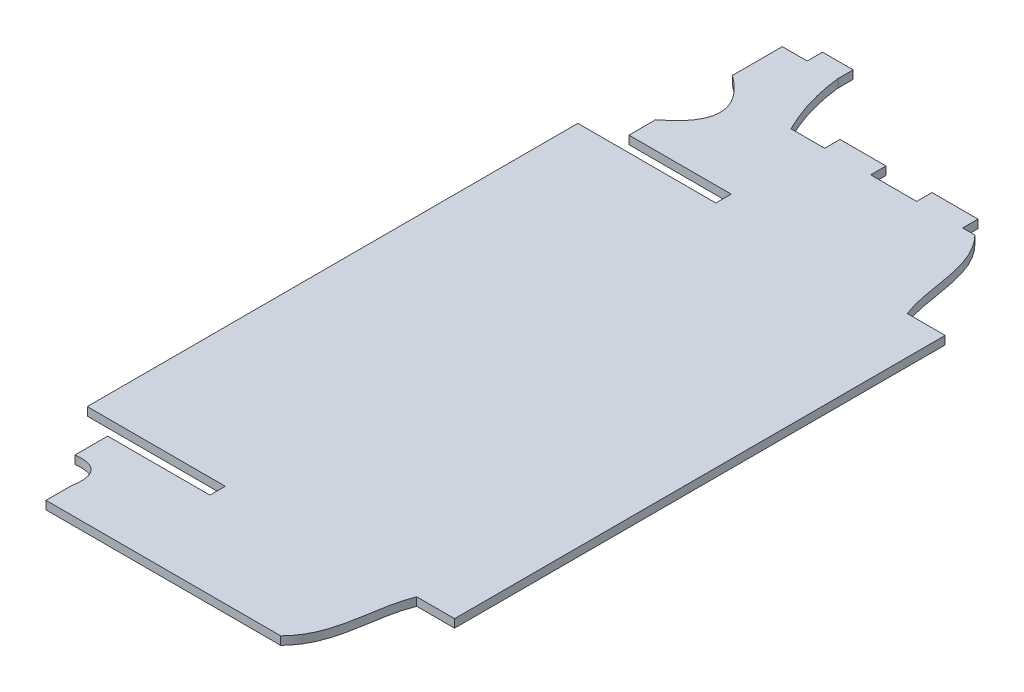
from build123d import *

# Parameters (mm, degrees)
SKETCH1_W           = 119.784208154
SKETCH1_H           = 2.7
BOSS_EXTRUDE1_DEPTH = 80
BOSS_EXTRUDE2_DEPTH = 2.7


with BuildPart() as part:
    # Sketch1 → Boss-Extrude1 (new, symmetric)
    with BuildSketch(Plane.XY):
        with Locations((-129.502935336, -130)):
            Rectangle(SKETCH1_W, SKETCH1_H)
    extrude(amount=BOSS_EXTRUDE1_DEPTH, both=True)

    # Sketch2 → Boss-Extrude2 (add)
    with BuildSketch(Plane(origin=(0, -128.65, 0), x_dir=(1, 0, 0), z_dir=(0, 1, 0))):
        with BuildLine():
            Line((-169.648055861, -113.2), (-93.105798555, -113.2))
            add(Edge.make_bspline(
                [(-81.948677427, -80), (-86.342810108, -90.98944534), (-84.004205112, -103.888102009), (-93.105798555, -113.2)],
                knots=[0, 0, 0, 0, 1, 1, 1, 1], degree=3))
            Line((-81.948677427, -80), (-81.948677427, -77.720195576))
            Line((-81.948677427, -77.720195576), (-177.731759246, -77.720195576))
            Line((-177.731759246, -77.720195576), (-177.731759246, -80))
            Line((-177.731759246, -80), (-144.395039413, -80))
            Line((-144.395039413, -80), (-144.395039413, -85))
            Line((-144.395039413, -85), (-177.731759246, -85))
            Line((-177.731759246, -85), (-177.731759246, -95.646483093))
            add(Edge.make_bspline(
                [(-169.648055861, -105.087652523), (-167.760228738, -94.514197341), (-177.731759246, -95.646483093)],
                knots=[0, 0, 0, 1, 1, 1], degree=2))
            Line((-169.648055861, -105.087652523), (-169.648055861, -113.2))
        make_face()
        with BuildLine():
            Line((-177.731759246, 80), (-177.731759246, 77.720195576))
            Line((-177.731759246, 77.720195576), (-81.948677427, 77.720195576))
            Line((-81.948677427, 77.720195576), (-81.948677427, 80))
            add(Edge.make_bspline(
                [(-81.948677427, 80), (-86.342810108, 90.98944534), (-84.004205112, 103.888102009), (-93.105798555, 113.2)],
                knots=[0, 0, 0, 0, 1, 1, 1, 1], degree=3))
            Line((-93.105798555, 113.2), (-97.105798555, 113.2))
            Line((-97.105798555, 113.2), (-97.105798555, 118.2))
            Line((-97.105798555, 118.2), (-112.105798555, 118.2))
            Line((-112.105798555, 118.2), (-112.105798555, 113.2))
            Line((-112.105798555, 113.2), (-127.105798555, 113.2))
            Line((-127.105798555, 113.2), (-127.105798555, 118.2))
            Line((-127.105798555, 118.2), (-142.105798555, 118.2))
            Line((-142.105798555, 118.2), (-142.105798555, 113.2))
            Line((-142.105798555, 113.2), (-153.105798555, 113.2))
            add(Edge.make_bspline(
                [(-153.105798555, 113.2), (-158.310437451, 123.519674565), (-159.620228805, 135)],
                knots=[0, 0, 0, 1, 1, 1], degree=2))
            Line((-159.620228805, 135), (-159.620228805, 140))
            Line((-159.620228805, 140), (-169.620228805, 140))
            Line((-169.620228805, 140), (-169.620228805, 135))
            Line((-169.620228805, 135), (-177.731759246, 135))
            Line((-177.731759246, 135), (-177.731759246, 118.728473066))
            add(Edge.make_bspline(
                [(-177.731759246, 93.702985707), (-160.836478184, 106.395581303), (-177.731759246, 118.728473066)],
                knots=[0, 0, 0, 1, 1, 1], degree=2))
            Line((-177.731759246, 93.702985707), (-177.731759246, 85))
            Line((-177.731759246, 85), (-144.395039413, 85))
            Line((-144.395039413, 85), (-144.395039413, 80))
            Line((-144.395039413, 80), (-177.731759246, 80))
        make_face()
    extrude(amount=-BOSS_EXTRUDE2_DEPTH)


solid = part.part
